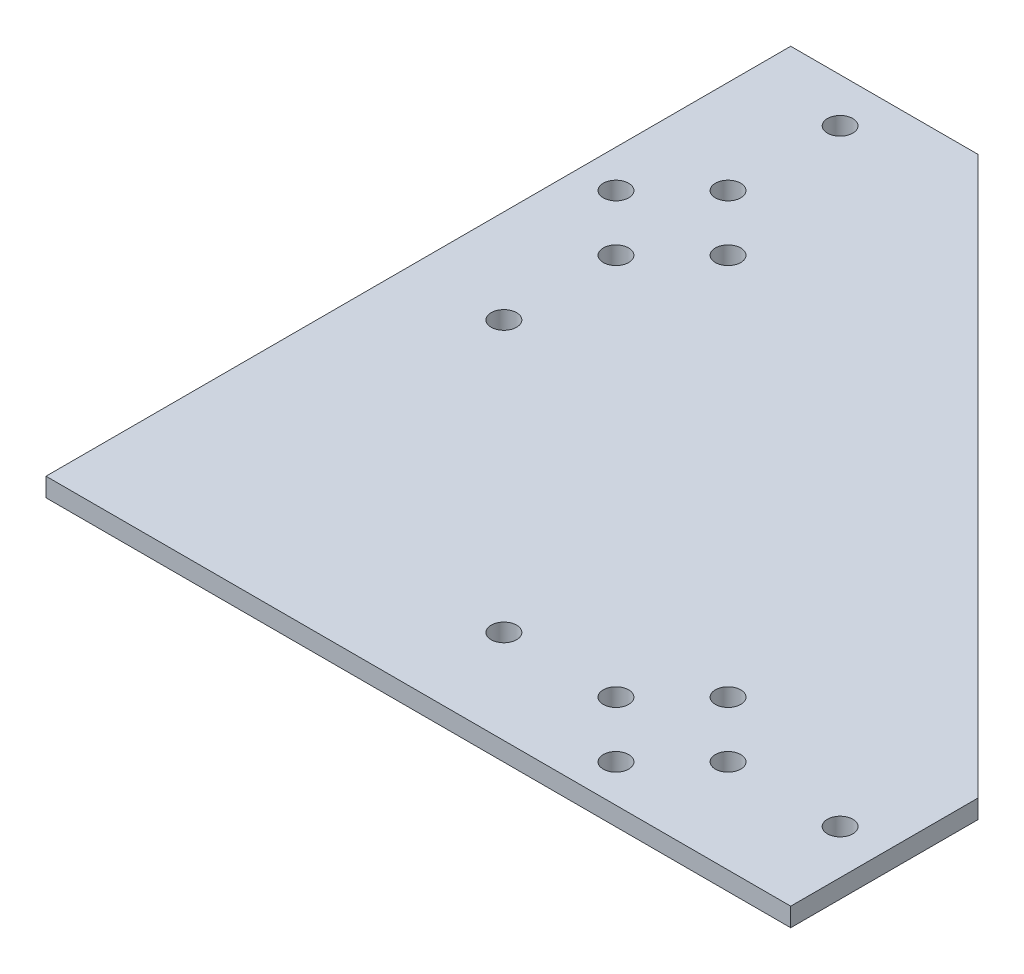
from build123d import *

# Parameters (mm, degrees)
BOSS_EXTRUDE1_DEPTH   = 3.175
F_8_CLEARANCE_HOLE1_D = 4.3053


with BuildPart() as part:
    # Sketch1 → Boss-Extrude1 (new body)
    with BuildSketch(Plane(origin=(0, 0, 0), x_dir=(1, 0, 0), z_dir=(0, 1, 0))):
        Polygon((126.25, 0), (0, 0), (0, 126.25), (31.75, 126.25), (126.25, 31.75), align=None)
    extrude(amount=BOSS_EXTRUDE1_DEPTH)

    # #8 Clearance Hole1 (through all)
    with Locations(Plane(origin=(0, 3.175, 0), x_dir=(1, 0, 0), z_dir=(0, 1, 0))):
        with Locations((15.875, 61.75), (15.875, 80.75), (6.375, 90.25), (25.375, 90.25), (15.875, 99.75), (15.875, 118.75), (118.75, 15.875), (99.75, 15.875), (90.25, 25.375), (90.25, 6.375), (80.75, 15.875), (61.75, 15.875)):
            Hole(F_8_CLEARANCE_HOLE1_D / 2)


solid = part.part
